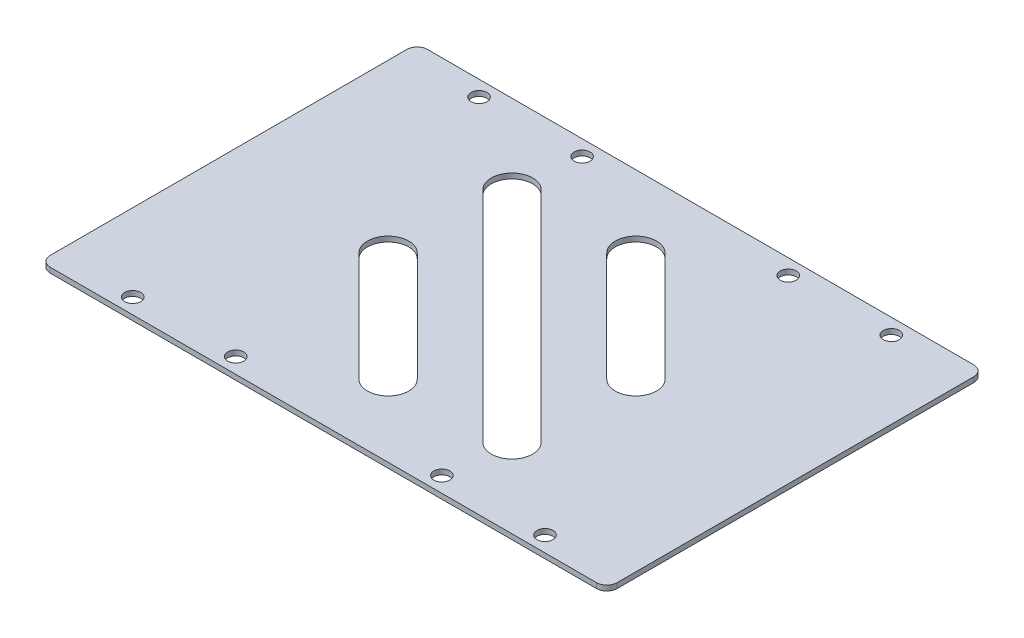
from build123d import *

# Parameters (mm, degrees)
SKETCH_1_W          = 110
SKETCH_1_H          = 73.2
EXTRUDE_1_DEPTH     = 1
SKETCH_2_R          = 1.55
CUT_EXTRUDE_1_DEPTH = 5
FILLET_1_R          = 2
CUT_EXTRUDE_4_DEPTH = 10


with BuildPart() as part:
    # 草图1 → 凸台-拉伸1 (new body)
    with BuildSketch(Plane(origin=(0, 0, 0), x_dir=(1, 0, 0), z_dir=(0, 1, 0))):
        Rectangle(SKETCH_1_W, SKETCH_1_H)
    extrude(amount=EXTRUDE_1_DEPTH)

    # 草图2 → 切除-拉伸1 (cut)
    with BuildSketch(Plane(origin=(0, 1, 0), x_dir=(1, 0, 0), z_dir=(0, 1, 0))):
        with Locations(Location((20, 33.6, 0), (0, 0, 270))):
            Circle(SKETCH_2_R)
        with Locations(Location((40, 33.6, 0), (0, 0, 270))):
            Circle(SKETCH_2_R)
        with Locations(Location((40, -33.6, 0), (0, 0, 270))):
            Circle(SKETCH_2_R)
        with Locations(Location((20, -33.6, 0), (0, 0, 270))):
            Circle(SKETCH_2_R)
        with Locations(Location((-20, -33.6, 0), (0, 0, 270))):
            Circle(SKETCH_2_R)
        with Locations(Location((-40, -33.6, 0), (0, 0, 270))):
            Circle(SKETCH_2_R)
        with Locations(Location((-40, 33.6, 0), (0, 0, 270))):
            Circle(SKETCH_2_R)
        with Locations(Location((-20, 33.6, 0), (0, 0, 270))):
            Circle(SKETCH_2_R)
    extrude(amount=-CUT_EXTRUDE_1_DEPTH, mode=Mode.SUBTRACT)

    # 圆角1
    fillet_1_edges = [part.edges().sort_by_distance(p)[0] for p in [
        (55, 0.5, 36.6),
        (-55, 0.5, 36.6),
        (-55, 0.5, -36.6),
        (55, 0.5, -36.6),
    ]]
    fillet(fillet_1_edges, radius=FILLET_1_R)

    # 草图4 → 切除-拉伸4 (cut)
    with BuildSketch(Plane(origin=(0, 1, 0), x_dir=(1, 0, 0), z_dir=(0, 1, 0))):
        with BuildLine():
            Line((-18.384776311, 24.04163056), (24.04163056, -18.384776311))
            ThreePointArc((24.04163056, -18.384776311), (24.04163056, -24.04163056), (18.384776311, -24.04163056))
            Line((18.384776311, -24.04163056), (-24.04163056, 18.384776311))
            ThreePointArc((-24.04163056, 18.384776311), (-24.04163056, 24.04163056), (-18.384776311, 24.04163056))
        make_face()
        with BuildLine():
            Line((4.242640687, 25.455844123), (25.455844123, 4.242640687))
            ThreePointArc((25.455844123, 4.242640687), (25.455844123, -1.414213562), (19.798989873, -1.414213562))
            Line((19.798989873, -1.414213562), (-1.414213562, 19.798989873))
            ThreePointArc((-1.414213562, 19.798989873), (-1.414213562, 25.455844123), (4.242640687, 25.455844123))
        make_face()
        with BuildLine():
            Line((-25.455844123, -4.242640687), (-4.242640687, -25.455844123))
            ThreePointArc((-4.242640687, -25.455844123), (1.414213562, -25.455844123), (1.414213562, -19.798989873))
            Line((1.414213562, -19.798989873), (-19.798989873, 1.414213562))
            ThreePointArc((-19.798989873, 1.414213562), (-25.455844123, 1.414213562), (-25.455844123, -4.242640687))
        make_face()
    extrude(amount=-CUT_EXTRUDE_4_DEPTH, mode=Mode.SUBTRACT)


solid = part.part
